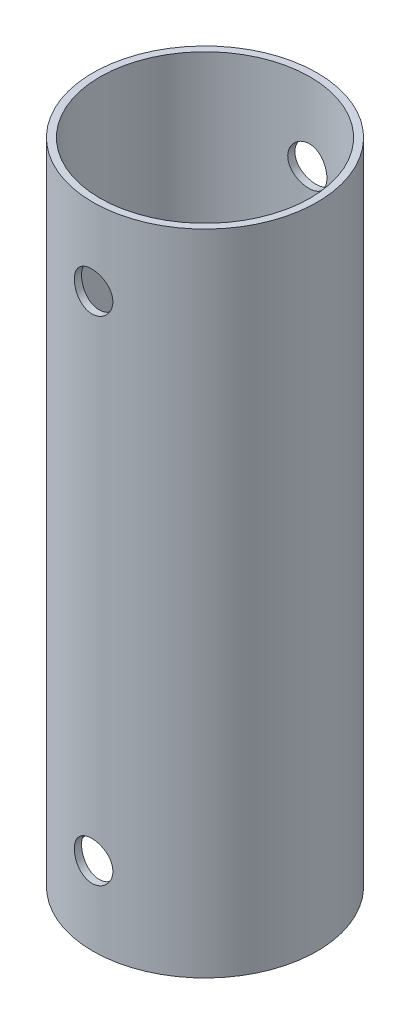
from build123d import *

# Parameters (mm, degrees)
SKETCH1_R               = 15.875
SKETCH1_R_2             = 14.875
BOSS_EXTRUDE1_DEPTH     = 91.814
CUT_EXTRUDE1_DEPTH      = 154.2
CUT_EXTRUDE1_DEPTH_BACK = 154.2
SKETCH2_R               = 2.75


with BuildPart() as part:
    # Sketch1 → Boss-Extrude1 (new body)
    with BuildSketch(Plane(origin=(0, 0, 0), x_dir=(1, 0, 0), z_dir=(0, 1, 0))):
        Circle(SKETCH1_R)
        Circle(SKETCH1_R_2, mode=Mode.SUBTRACT)
    extrude(amount=BOSS_EXTRUDE1_DEPTH)

    # Sketch2 → Cut-Extrude1 (cut, two sides: drawn at the far end of the back side and taken through both)
    with BuildSketch(Plane.XY.offset(-CUT_EXTRUDE1_DEPTH_BACK)):
        with Locations((-0.133461596, 80.814)):
            Circle(SKETCH2_R)
        with Locations((-0.133461596, 11)):
            Circle(SKETCH2_R)
    extrude(amount=CUT_EXTRUDE1_DEPTH + CUT_EXTRUDE1_DEPTH_BACK, mode=Mode.SUBTRACT)


solid = part.part
